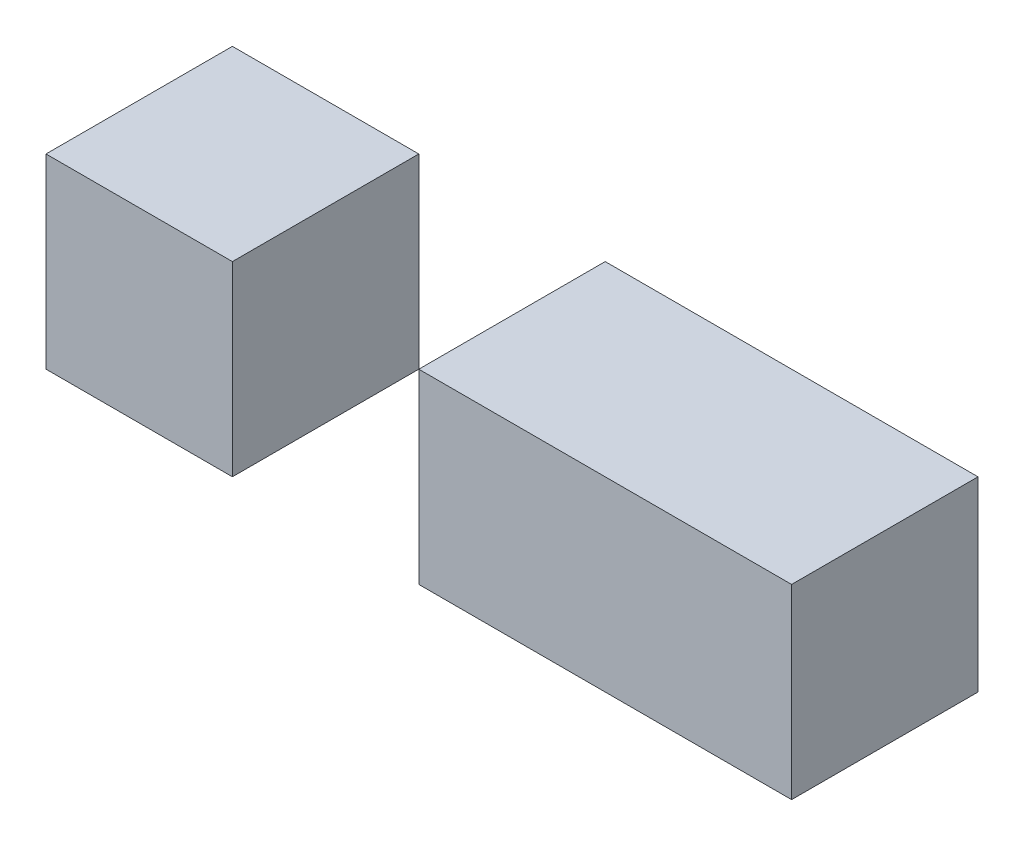
from build123d import *

# Parameters (mm, degrees)
SELECTIONSEED_W          = 10
SELECTIONSEED_H          = 10
SELECTIONEXTRUDE_DEPTH   = 10
SELECTIONSEED_W_2        = 20
SELECTIONEXTRUDE_2_DEPTH = 10


with BuildPart() as part:
    # SelectionSeed → SelectionExtrude (new body)
    with BuildSketch(Plane.XY):
        with Locations((5, 5)):
            Rectangle(SELECTIONSEED_W, SELECTIONSEED_H)
    extrude(amount=SELECTIONEXTRUDE_DEPTH)


with BuildPart() as body_2:
    # SelectionSeed → SelectionExtrude 2 (new body)
    with BuildSketch(Plane.XY):
        with Locations((30, 5)):
            Rectangle(SELECTIONSEED_W_2, SELECTIONSEED_H)
    extrude(amount=SELECTIONEXTRUDE_2_DEPTH)


solid = Compound([part.part, body_2.part])
